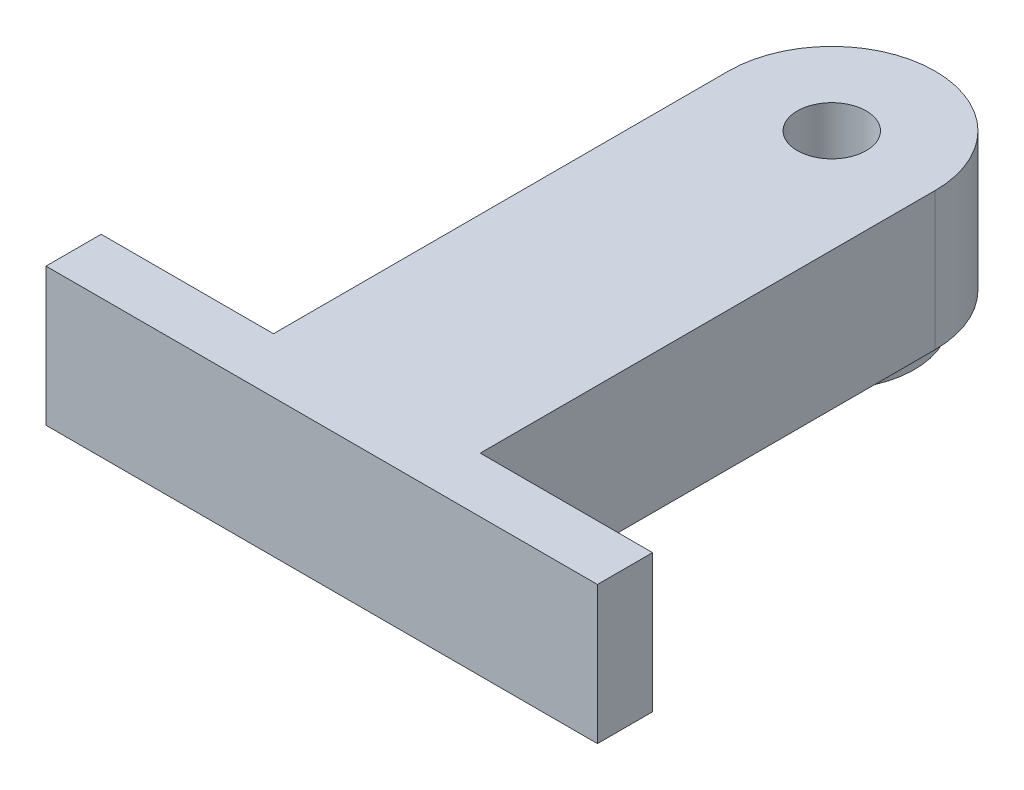
from build123d import *
from build123d.topology import SkipClean

# Parameters (mm, degrees)
CROQUIS2_R              = 75
CROQUIS2_R_2            = 25
CROQUIS2_W              = 400
CROQUIS2_H              = 40
SALIENTE_EXTRUIR1_DEPTH = 100
SALIENTE_EXTRUIR2_START = 20
CROQUIS3_R              = 60
CROQUIS3_R_2            = 25
SALIENTE_EXTRUIR2_DEPTH = 20


with BuildPart() as part:
    # Croquis2 → Saliente-Extruir1 (new body)
    # profile 1 of 3: a face of its own
    with BuildSketch(Plane(origin=(0, 0, 0), x_dir=(1, 0, 0), z_dir=(0, 1, 0))):
        with Locations((-200, 370)):
            Circle(CROQUIS2_R)
        with Locations(Location((-200, 370, 0), (0, 0, 270))):
            Circle(CROQUIS2_R_2, mode=Mode.SUBTRACT)
    # profile 2 of 3: a face of its own
    with BuildSketch(Plane(origin=(0, 0, 0), x_dir=(1, 0, 0), z_dir=(0, 1, 0))):
        with BuildLine():
            Line((-275, 345), (-275, 40))
            Line((-275, 40), (-200, 40))
            Line((-200, 40), (-125, 40))
            Line((-125, 40), (-125, 345))
            Line((-125, 345), (-125, 370))
            ThreePointArc((-125, 370), (-200, 295), (-275, 370))
            Line((-275, 370), (-275, 345))
        make_face()
    # profile 3 of 3: a face of its own
    with BuildSketch(Plane(origin=(0, 0, 0), x_dir=(1, 0, 0), z_dir=(0, 1, 0))):
        with Locations((-200, 20)):
            Rectangle(CROQUIS2_W, CROQUIS2_H)
    extrude(amount=SALIENTE_EXTRUIR1_DEPTH)

    # Croquis3 → Saliente-Extruir2 (add)
    with SkipClean():  # the faces are left unmerged after this step: merging them gives an invalid solid
        with BuildSketch(Plane(origin=(0, 0, 0), x_dir=(-1, 0, 0), z_dir=(0, -1, 0)).offset(SALIENTE_EXTRUIR2_START)):
            with Locations(Location((200, 370, 0), (0, 0, 90))):
                Circle(CROQUIS3_R)
            with Locations(Location((200, 370, 0), (0, 0, 90))):
                Circle(CROQUIS3_R_2, mode=Mode.SUBTRACT)
        extrude(amount=-SALIENTE_EXTRUIR2_DEPTH)


solid = part.part
